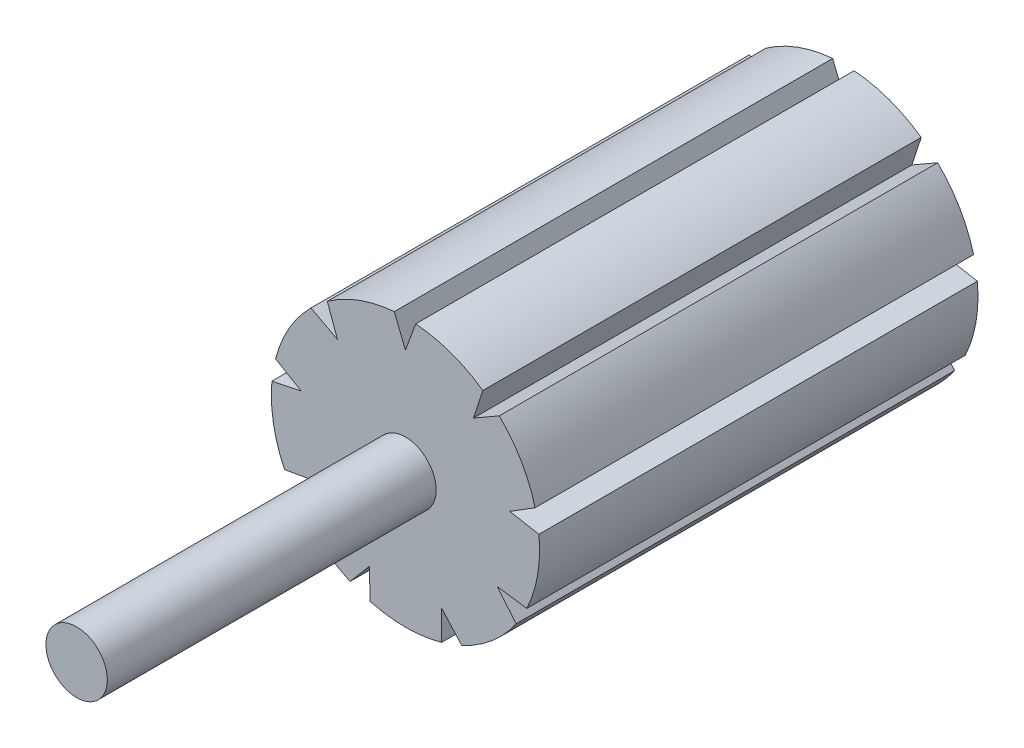
from build123d import *

# Parameters (mm, degrees)
BOSS_EXTRUDE1_DEPTH = 20
SKETCH2_R           = 1.400281721
BOSS_EXTRUDE3_DEPTH = 15


with BuildPart() as part:
    # Sketch1 → Boss-Extrude1 (new body)
    with BuildSketch(Plane.XY):
        with BuildLine():
            Line((3.102637299, 3.697579148), (4.279619218, 4.373206779))
            ThreePointArc((4.279619218, 4.373206779), (5.288327072, 3.077933555), (5.916340543, 1.561087044))
            Line((5.916340543, 1.561087044), (4.753516124, 0.838173146))
            Line((4.753516124, 0.838173146), (6.089421653, 0.599184544))
            ThreePointArc((6.089421653, 0.599184544), (6.029551119, -1.041437222), (5.535627206, -2.607088341))
            Line((5.535627206, -2.607088341), (4.180171925, -2.413423386))
            Line((4.180171925, -2.413423386), (5.04991602, -3.455202798))
            ThreePointArc((5.04991602, -3.455202798), (3.949481187, -4.673507948), (2.564732378, -5.555378116))
            Line((2.564732378, -5.555378116), (1.650878825, -4.535752294))
            Line((1.650878825, -4.535752294), (1.647498557, -5.892862351))
            ThreePointArc((1.647498557, -5.892862351), (0.021405114, -6.118792365), (-1.606229234, -5.90424473))
            Line((-1.606229234, -5.90424473), (-1.650878825, -4.535752294))
            Line((-1.650878825, -4.535752294), (-2.52580179, -5.573186118))
            ThreePointArc((-2.52580179, -5.573186118), (-3.91668665, -4.701025832), (-5.025618336, -3.490449616))
            Line((-5.025618336, -3.490449616), (-4.180171925, -2.413423386))
            Line((-4.180171925, -2.413423386), (-5.517251408, -2.645754161))
            ThreePointArc((-5.517251408, -2.645754161), (-6.022117201, -1.083597066), (-6.093464765, 0.556565665))
            Line((-6.093464765, 0.556565665), (-4.753516124, 0.838173146))
            Line((-4.753516124, 0.838173146), (-5.927117776, 1.519655572))
            ThreePointArc((-5.927117776, 1.519655572), (-5.309732185, 3.04085881), (-4.310111309, 4.343157686))
            Line((-4.310111309, 4.343157686), (-3.102637299, 3.697579148))
            Line((-3.102637299, 3.697579148), (-3.563619863, 4.974001574))
            ThreePointArc((-3.563619863, 4.974001574), (-2.112864469, 5.742463053), (-0.51000887, 6.097537957))
            Line((-0.51000887, 6.097537957), (0, 4.826846773))
            Line((0, 4.826846773), (0.467335389, 6.100956959))
            ThreePointArc((0.467335389, 6.100956959), (2.072636014, 5.757105014), (3.528732387, 4.998812451))
            Line((3.528732387, 4.998812451), (3.102637299, 3.697579148))
        make_face()
    extrude(amount=BOSS_EXTRUDE1_DEPTH)

    # Sketch2 → Boss-Extrude3 (add)
    with BuildSketch(Plane.XY.offset(20)):
        Circle(SKETCH2_R)
    extrude(amount=BOSS_EXTRUDE3_DEPTH)


solid = part.part
